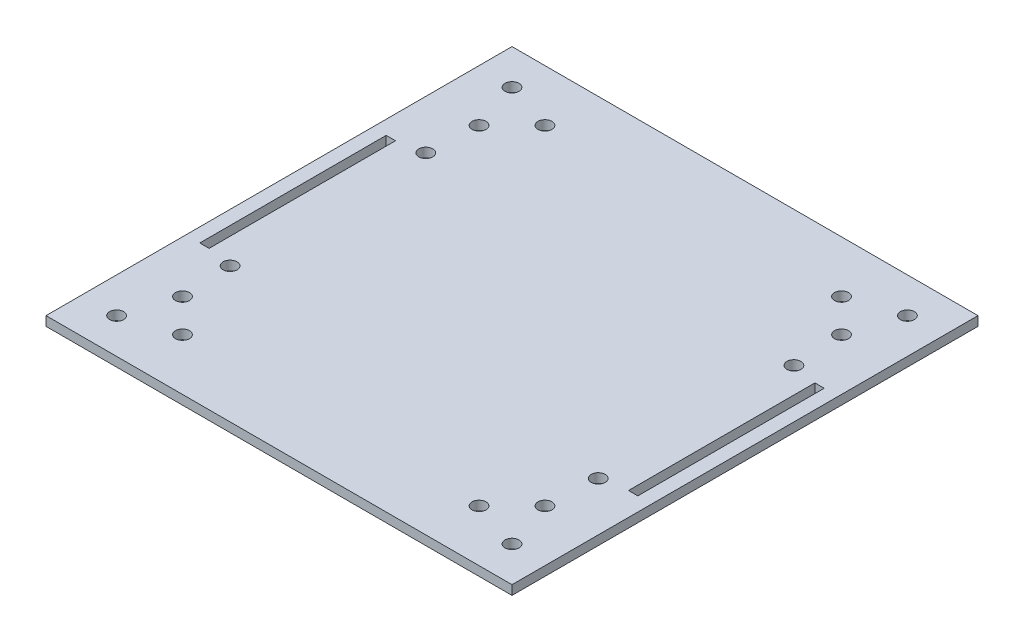
from build123d import *

# Parameters (mm, degrees)
SKETCH_1_W          = 100
SKETCH_1_H          = 100
EXTRUDE_1_DEPTH     = 2
SKETCH_3_R          = 1.5
CUT_EXTRUDE_2_DEPTH = 71.738956735
SKETCH_4_R          = 1.5
CUT_EXTRUDE_3_DEPTH = 71.738956735
SKETCH_5_W          = 2
SKETCH_5_H          = 40
CUT_EXTRUDE_4_DEPTH = 71.738956735


with BuildPart() as part:
    # 草图1 → 凸台-拉伸1 (new body)
    with BuildSketch(Plane(origin=(0, 0, 0), x_dir=(1, 0, 0), z_dir=(0, 1, 0))):
        Rectangle(SKETCH_1_W, SKETCH_1_H)
    extrude(amount=EXTRUDE_1_DEPTH)

    # 草图3 → 切除-拉伸2 (cut, through all)
    with BuildSketch(Plane(origin=(0, 2, 0), x_dir=(1, 0, 0), z_dir=(0, 1, 0))):
        with Locations(Location((-42.426406871, 42.426406871, 0), (0, 0, 270))):
            Circle(SKETCH_3_R)
        with Locations(Location((-31.819805153, 38.890872965, 0), (0, 0, 270))):
            Circle(SKETCH_3_R)
        with Locations(Location((-38.890872965, 31.819805153, 0), (0, 0, 270))):
            Circle(SKETCH_3_R)
        with Locations(Location((-31.819805153, -38.890872965, 0), (0, 0, 90))):
            Circle(SKETCH_3_R)
        with Locations(Location((-38.890872965, -31.819805153, 0), (0, 0, 90))):
            Circle(SKETCH_3_R)
        with Locations(Location((-42.426406871, -42.426406871, 0), (0, 0, 90))):
            Circle(SKETCH_3_R)
        with Locations(Location((31.819805153, 38.890872965, 0), (0, 0, 90))):
            Circle(SKETCH_3_R)
        with Locations(Location((38.890872965, 31.819805153, 0), (0, 0, 90))):
            Circle(SKETCH_3_R)
        with Locations(Location((42.426406871, 42.426406871, 0), (0, 0, 90))):
            Circle(SKETCH_3_R)
        with Locations(Location((31.819805153, -38.890872965, 0), (0, 0, 270))):
            Circle(SKETCH_3_R)
        with Locations(Location((42.426406871, -42.426406871, 0), (0, 0, 270))):
            Circle(SKETCH_3_R)
        with Locations(Location((38.890872965, -31.819805153, 0), (0, 0, 270))):
            Circle(SKETCH_3_R)
    extrude(amount=-CUT_EXTRUDE_2_DEPTH, mode=Mode.SUBTRACT)

    # 草图4 → 切除-拉伸3 (cut, through all)
    with BuildSketch(Plane.XZ):
        with Locations(Location((-39.5, 21, 0), (0, 0, 270))):
            Circle(SKETCH_4_R)
        with Locations(Location((39.5, 21, 0), (0, 0, 90))):
            Circle(SKETCH_4_R)
        with Locations(Location((39.5, -21, 0), (0, 0, 270))):
            Circle(SKETCH_4_R)
        with Locations(Location((-39.5, -21, 0), (0, 0, 90))):
            Circle(SKETCH_4_R)
    extrude(amount=-CUT_EXTRUDE_3_DEPTH, mode=Mode.SUBTRACT)

    # 草图5 → 切除-拉伸4 (cut, through all)
    with BuildSketch(Plane.XZ):
        with Locations((-46, 0)):
            Rectangle(SKETCH_5_W, SKETCH_5_H)
        with Locations((46, 0)):
            Rectangle(SKETCH_5_W, SKETCH_5_H)
    extrude(amount=-CUT_EXTRUDE_4_DEPTH, mode=Mode.SUBTRACT)


solid = part.part
